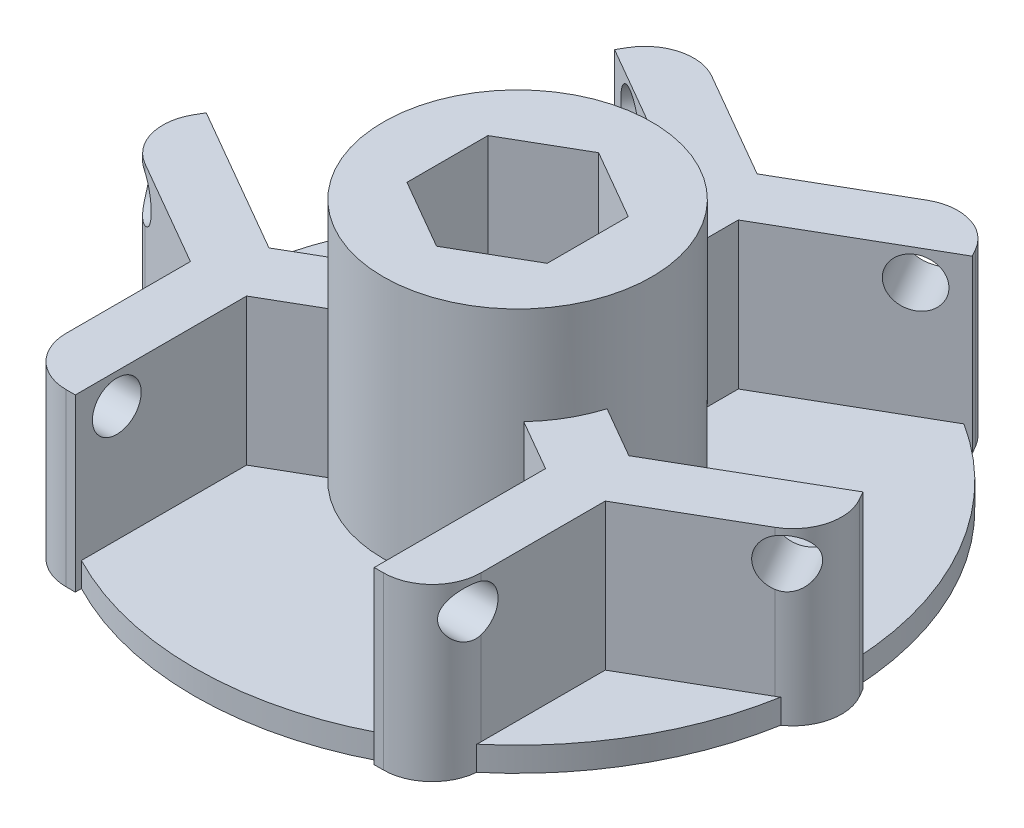
from build123d import *

# Parameters (mm, degrees)
SALIENTE_EXTRUIR1_DEPTH      = 2
SALIENTE_EXTRUIR1_DEPTH_BACK = 2
CROQUIS2_R                   = 26.5
SALIENTE_EXTRUIR2_DEPTH      = 22
SALIENTE_EXTRUIR2_DEPTH_BACK = 22
CROQUIS3_R                   = 11
CROQUIS5_W                   = 5
CROQUIS5_H                   = 10.605029608
SALIENTE_EXTRUIR3_DEPTH      = 14
SALIENTE_EXTRUIR5_DEPTH      = 14
CROQUIS7_W                   = 24.5
CROQUIS7_H                   = 19
SALIENTE_EXTRUIR12_DEPTH     = 21
CROQUIS8_R                   = 2
CORTAR_EXTRUIR1_DEPTH        = 37
CROQUIS10_W                  = 24.5
CROQUIS10_H                  = 19
CORTAR_EXTRUIR2_DEPTH        = 19
MATRIZC2_COUNT               = 3
CORTAR_EXTRUIR3_START        = -19
CORTAR_EXTRUIR3_DEPTH        = 19
CORTAR_EXTRUIR5_DEPTH        = 33
CORTAR_EXTRUIR5_DEPTH_BACK   = 33
CROQUIS15_W                  = 59.132564764
CROQUIS15_H                  = 24.236023023
CROQUIS16_R                  = 0.5
CORTAR_EXTRUIR6_DEPTH        = 10
CORTAR_EXTRUIR8_START        = -0.1
CROQUIS17_R                  = 0.5
CORTAR_EXTRUIR8_DEPTH        = 0.1


with BuildPart() as part:
    # Croquis2 → Saliente-Extruir1 (new, two sides: drawn at the far end of the back side and taken through both)
    with BuildSketch(Plane(origin=(0, 0, 0), x_dir=(1, 0, 0), z_dir=(0, 1, 0)).offset(-SALIENTE_EXTRUIR1_DEPTH_BACK)):
        Circle(CROQUIS2_R)
    extrude(amount=SALIENTE_EXTRUIR1_DEPTH + SALIENTE_EXTRUIR1_DEPTH_BACK)

    # Croquis3 → Saliente-Extruir2 (add, two sides: drawn at the far end of the back side and taken through both)
    with BuildSketch(Plane(origin=(0, 0, 0), x_dir=(1, 0, 0), z_dir=(0, 1, 0)).offset(-SALIENTE_EXTRUIR2_DEPTH_BACK)):
        Circle(CROQUIS3_R)
        Polygon((0, 6.639528096), (-5.75, 3.319764048), (-5.75, -3.319764048), (0, -6.639528096), (5.75, -3.319764048), (5.75, 3.319764048), align=None, mode=Mode.SUBTRACT)
    extrude(amount=SALIENTE_EXTRUIR2_DEPTH + SALIENTE_EXTRUIR2_DEPTH_BACK)

    # Croquis5 → Saliente-Extruir3 (add)
    with BuildSketch(Plane(origin=(0, 0, 0), x_dir=(1, 0, 0), z_dir=(0, 1, 0))):
        with Locations((0, 13.697485196)):
            Rectangle(CROQUIS5_W, CROQUIS5_H)
        Polygon((8.520257623, -2.032421687), (17.704482672, -7.334936491), (15.204482672, -11.665063509), (6.020257623, -6.362548705), align=None)
        Polygon((-6.020257623, -6.362548705), (-15.204482672, -11.665063509), (-17.704482672, -7.334936491), (-8.520257623, -2.032421687), align=None)
    extrude(amount=SALIENTE_EXTRUIR3_DEPTH)

    # Croquis6 → Saliente-Extruir5 (add)
    with BuildSketch(Plane(origin=(0, 0, 0), x_dir=(1, 0, 0), z_dir=(0, 1, 0))):
        with BuildLine():
            Line((-12.25, -11), (-12.25, -24))
            Line((-12.25, -24), (-13, -24))
            ThreePointArc((-13, -24), (-15.828427125, -22.828427125), (-17, -20))
            Line((-17, -20), (-17, -9))
            Line((-17, -9), (-12.25, -9))
            Line((-12.25, -9), (-12.25, -11))
        make_face()
        with BuildLine():
            Line((12.25, -11), (12.25, -24))
            Line((12.25, -24), (13, -24))
            ThreePointArc((13, -24), (15.828427125, -22.828427125), (17, -20))
            Line((17, -20), (17, -9))
            Line((17, -9), (12.25, -9))
            Line((12.25, -9), (12.25, -11))
        make_face()
        with BuildLine():
            Line((-1.669228634, 15.108811196), (0.705771366, 19.222431864))
            Line((0.705771366, 19.222431864), (-8.820508076, 24.722431864))
            ThreePointArc((-8.820508076, 24.722431864), (-11.855784256, 25.122033554), (-14.284609691, 23.258330249))
            Line((-14.284609691, 23.258330249), (-14.659609691, 22.608811196))
            Line((-14.659609691, 22.608811196), (-3.401279442, 16.108811196))
            Line((-3.401279442, 16.108811196), (-1.669228634, 15.108811196))
        make_face()
        with BuildLine():
            Line((-15.651279442, -5.108811196), (-26.909609691, 1.391188804))
            Line((-26.909609691, 1.391188804), (-27.284609691, 0.741669751))
            ThreePointArc((-27.284609691, 0.741669751), (-27.684211381, -2.29360643), (-25.820508076, -4.722431864))
            Line((-25.820508076, -4.722431864), (-16.294228634, -10.222431864))
            Line((-16.294228634, -10.222431864), (-13.919228634, -6.108811196))
            Line((-13.919228634, -6.108811196), (-15.651279442, -5.108811196))
        make_face()
        with BuildLine():
            Line((13.919228634, -6.108811196), (16.294228634, -10.222431864))
            Line((16.294228634, -10.222431864), (25.820508076, -4.722431864))
            ThreePointArc((25.820508076, -4.722431864), (27.684211381, -2.29360643), (27.284609691, 0.741669751))
            Line((27.284609691, 0.741669751), (26.909609691, 1.391188804))
            Line((26.909609691, 1.391188804), (15.651279442, -5.108811196))
            Line((15.651279442, -5.108811196), (13.919228634, -6.108811196))
        make_face()
        with BuildLine():
            Line((3.401279442, 16.108811196), (14.659609691, 22.608811196))
            Line((14.659609691, 22.608811196), (14.284609691, 23.258330249))
            ThreePointArc((14.284609691, 23.258330249), (11.855784256, 25.122033554), (8.820508076, 24.722431864))
            Line((8.820508076, 24.722431864), (-0.705771366, 19.222431864))
            Line((-0.705771366, 19.222431864), (1.669228634, 15.108811196))
            Line((1.669228634, 15.108811196), (3.401279442, 16.108811196))
        make_face()
    extrude(amount=SALIENTE_EXTRUIR5_DEPTH)

    # Croquis7 → Saliente-Extruir12 (add)
    with BuildSketch(Plane(origin=(0, 0, 0), x_dir=(1, 0, 0), z_dir=(0, 1, 0))):
        with Locations((0, -20.6)):
            Rectangle(CROQUIS7_W, CROQUIS7_H)
    extrude(amount=SALIENTE_EXTRUIR12_DEPTH)

    # Croquis8 → Cortar-Extruir1 (cut, symmetric)
    with BuildSketch(Plane(origin=(12.25, 0, 0), x_dir=(0, 0, -1), z_dir=(1, 0, 0))):
        with Locations((-20.6, 11.5)):
            Circle(CROQUIS8_R)
    cortar_extruir1 = extrude(amount=CORTAR_EXTRUIR1_DEPTH, both=True, mode=Mode.SUBTRACT)

    # Croquis10 → Cortar-Extruir2 (cut)
    with BuildSketch(Plane(origin=(0, 21, 0), x_dir=(1, 0, 0), z_dir=(0, 1, 0))):
        with Locations((0, -20.6)):
            Rectangle(CROQUIS10_W, CROQUIS10_H)
    extrude(amount=-CORTAR_EXTRUIR2_DEPTH, mode=Mode.SUBTRACT)

    # MatrizC2: Cortar-Extruir1 ×3 about axis
    matrizc2_axis = Axis((0, -24.2, 0), (0, 1, 0))
    for i in range(1, MATRIZC2_COUNT):
        add(cortar_extruir1.rotate(matrizc2_axis, i * 360 / MATRIZC2_COUNT), mode=Mode.SUBTRACT)

    # Croquis14 → Cortar-Extruir3 (cut)
    with BuildSketch(Plane(origin=(0, 2, 0), x_dir=(1, 0, 0), z_dir=(0, 1, 0)).offset(CORTAR_EXTRUIR3_START)):
        with BuildLine():
            Line((-12.25, -24), (-12.25, -30.1))
            Line((-12.25, -30.1), (12.25, -30.1))
            Line((12.25, -30.1), (12.25, -24))
            Line((12.25, -24), (12.25, -23.498670175))
            ThreePointArc((12.25, -23.498670175), (0, -26.5), (-12.25, -23.498670175))
            Line((-12.25, -23.498670175), (-12.25, -24))
        make_face()
    extrude(amount=CORTAR_EXTRUIR3_DEPTH, mode=Mode.SUBTRACT)

    # Croquis15 → Cortar-Extruir5 (cut, two sides: drawn at the far end of the back side and taken through both)
    with BuildSketch(Plane.XY.offset(-CORTAR_EXTRUIR5_DEPTH_BACK)):
        with Locations((-0.66628242, -12.118011512)):
            Rectangle(CROQUIS15_W, CROQUIS15_H)
    extrude(amount=CORTAR_EXTRUIR5_DEPTH + CORTAR_EXTRUIR5_DEPTH_BACK, mode=Mode.SUBTRACT)

    # Croquis16 → Cortar-Extruir6 (cut)
    with BuildSketch(Plane(origin=(0, 2, 0), x_dir=(1, 0, 0), z_dir=(0, 1, 0))):
        Circle(CROQUIS16_R)
    extrude(amount=-CORTAR_EXTRUIR6_DEPTH, mode=Mode.SUBTRACT)

    # Croquis17 → Cortar-Extruir8 (cut)
    with BuildSketch(Plane.XZ.offset(CORTAR_EXTRUIR8_START)):
        Polygon((-1.075157711, 0.5), (-1.075157711, -0.5), (-0.5, -0.5), (-0.5, -0.823598898), (0.5, -0.823598898), (0.5, -0.5), (1.075157711, -0.5), (1.075157711, 0.5), (0.5, 0.5), (0.5, 0.823598898), (-0.5, 0.823598898), (-0.5, 0.5), align=None)
        Circle(CROQUIS17_R, mode=Mode.SUBTRACT)
    extrude(amount=CORTAR_EXTRUIR8_DEPTH, mode=Mode.SUBTRACT)


solid = part.part
